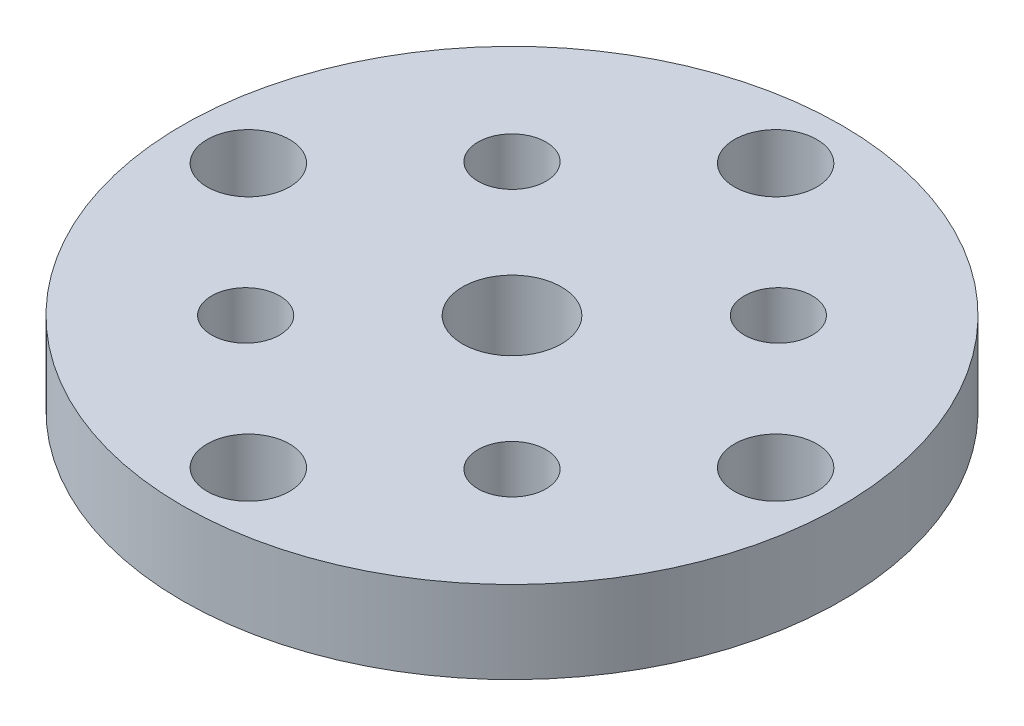
from build123d import *

# Parameters (mm, degrees)
SKETCH1_R           = 10
SKETCH1_R_2         = 1.25
SKETCH1_R_3         = 1.5
BOSS_EXTRUDE1_DEPTH = 2.5
SKETCH2_R           = 1.03251
CUT_EXTRUDE1_DEPTH  = 15.361406616


with BuildPart() as part:
    # Sketch1 → Boss-Extrude1 (new body)
    with BuildSketch(Plane(origin=(0, 0, 0), x_dir=(1, 0, 0), z_dir=(0, 1, 0))):
        with Locations(Location((0, 0, 0), (0, 0, 270))):
            Circle(SKETCH1_R)
        with Locations(Location((-8, 0, 0), (0, 0, 270))):
            Circle(SKETCH1_R_2, mode=Mode.SUBTRACT)
        with Locations(Location((0, -8, 0), (0, 0, 270))):
            Circle(SKETCH1_R_2, mode=Mode.SUBTRACT)
        with Locations(Location((8, 0, 0), (0, 0, 270))):
            Circle(SKETCH1_R_2, mode=Mode.SUBTRACT)
        with Locations(Location((0, 8, 0), (0, 0, 270))):
            Circle(SKETCH1_R_2, mode=Mode.SUBTRACT)
        with Locations(Location((0, 0, 0), (0, 0, 270))):
            Circle(SKETCH1_R_3, mode=Mode.SUBTRACT)
    extrude(amount=BOSS_EXTRUDE1_DEPTH)

    # Sketch2 → Cut-Extrude1 (cut, through all)
    with BuildSketch(Plane(origin=(0, 2.5, 0), x_dir=(1, 0, 0), z_dir=(0, 1, 0))):
        with Locations(Location((-4.041115254, 4.041115254, 0), (0, 0, 270))):
            Circle(SKETCH2_R)
        with Locations(Location((4.041115254, 4.041115254, 0), (0, 0, 270))):
            Circle(SKETCH2_R)
        with Locations(Location((4.041115254, -4.041115254, 0), (0, 0, 270))):
            Circle(SKETCH2_R)
        with Locations(Location((-4.041115254, -4.041115254, 0), (0, 0, 270))):
            Circle(SKETCH2_R)
    extrude(amount=-CUT_EXTRUDE1_DEPTH, mode=Mode.SUBTRACT)


solid = part.part
